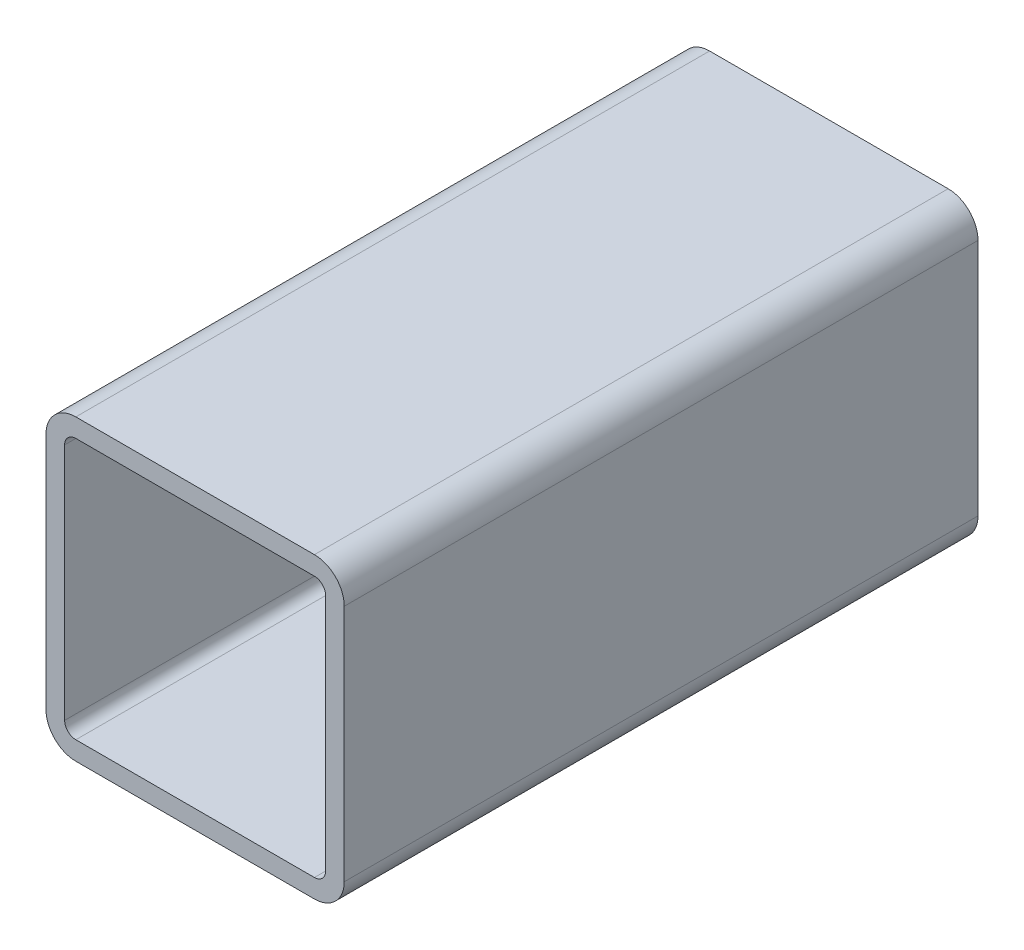
from build123d import *

# Parameters (mm, degrees)
DODANIE_WYCI_GNI_CIE1_DEPTH = 170


with BuildPart() as part:
    # Szkic1 → Dodanie-wyciągnięcie1 (new body)
    with BuildSketch(Plane.XY):
        with BuildLine():
            Line((-488, 0), (-552, 0))
            ThreePointArc((-552, 0), (-557.656854249, 2.343145751), (-560, 8))
            Line((-560, 8), (-560, 72))
            ThreePointArc((-560, 72), (-557.656854249, 77.656854249), (-552, 80))
            Line((-552, 80), (-488, 80))
            ThreePointArc((-488, 80), (-482.343145751, 77.656854249), (-480, 72))
            Line((-480, 72), (-480, 8))
            ThreePointArc((-480, 8), (-482.343145751, 2.343145751), (-488, 0))
        make_face()
        with BuildLine():
            Line((-488, 5), (-552, 5))
            ThreePointArc((-552, 5), (-554.121320344, 5.878679656), (-555, 8))
            Line((-555, 8), (-555, 72))
            ThreePointArc((-555, 72), (-554.121320344, 74.121320344), (-552, 75))
            Line((-552, 75), (-488, 75))
            ThreePointArc((-488, 75), (-485.878679656, 74.121320344), (-485, 72))
            Line((-485, 72), (-485, 8))
            ThreePointArc((-485, 8), (-485.878679656, 5.878679656), (-488, 5))
        make_face(mode=Mode.SUBTRACT)
    extrude(amount=DODANIE_WYCI_GNI_CIE1_DEPTH)


solid = part.part
